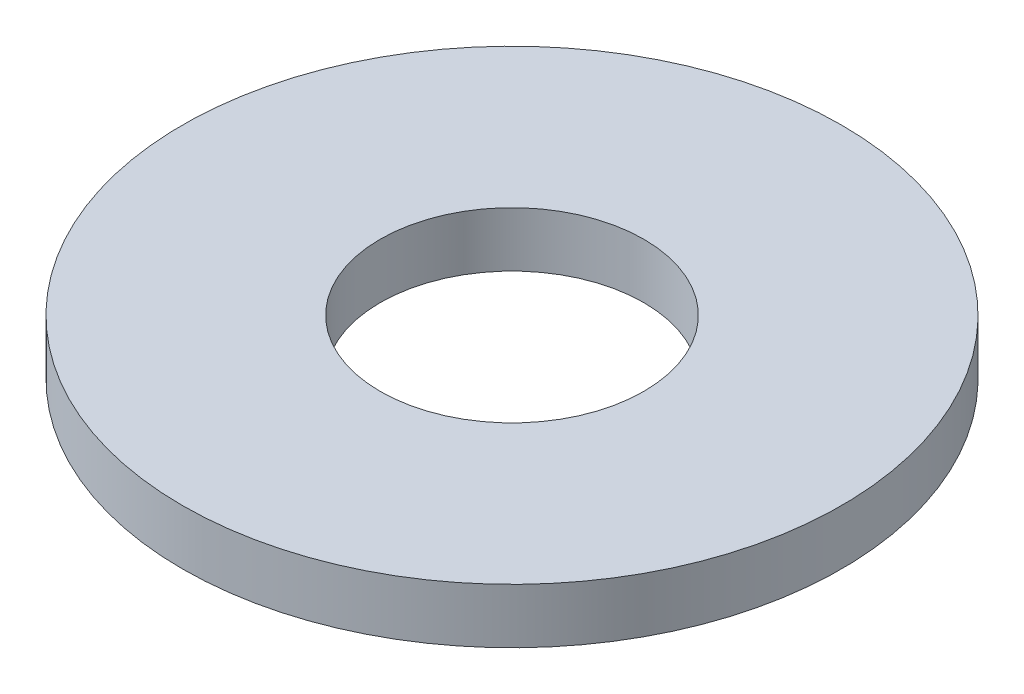
from build123d import *

# Parameters (mm, degrees)
SKETCH1_R           = 15
SKETCH1_R_2         = 6
BOSS_EXTRUDE1_DEPTH = 2.5


with BuildPart() as part:
    # Sketch1 → Boss-Extrude1 (new body)
    with BuildSketch(Plane(origin=(0, 0, 0), x_dir=(1, 0, 0), z_dir=(0, 1, 0))):
        with Locations(Location((0, 0, 0), (0, 0, 270))):
            Circle(SKETCH1_R)
        with Locations(Location((0, 0, 0), (0, 0, 270))):
            Circle(SKETCH1_R_2, mode=Mode.SUBTRACT)
    extrude(amount=BOSS_EXTRUDE1_DEPTH)


solid = part.part
